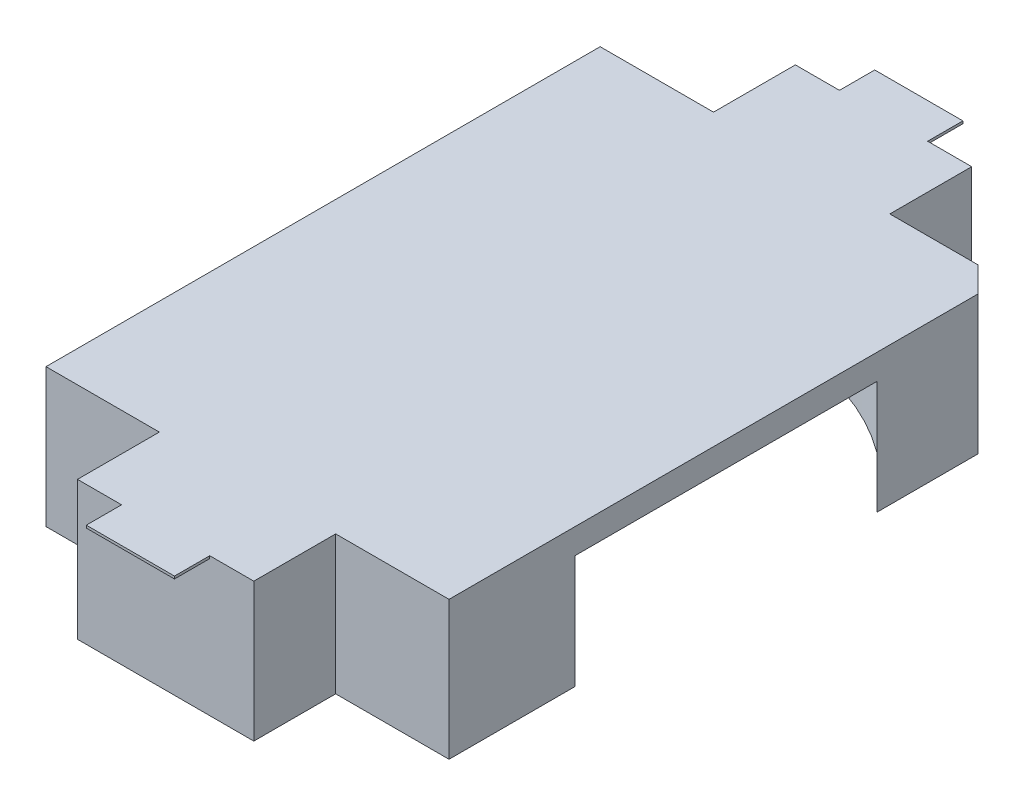
from build123d import *

# Parameters (mm, degrees)
BOSS_EXTRUDE1_DEPTH   = 1
BOSS_EXTRUDE2_DEPTH   = 4.5
SKETCH3_W             = 7
SKETCH3_H             = 3.25
BOSS_EXTRUDE3_DEPTH   = 5.5
SKETCH4_W             = 3.5
SKETCH4_H             = 31.3
BOSS_EXTRUDE4_DEPTH   = 0.1
SKETCH5_W             = 0.994211342
SKETCH5_H             = 2.867053464
BOSS_EXTRUDE6_DEPTH   = 0.1
BOSS_EXTRUDE6_2_DEPTH = 0.1


with BuildPart() as part:
    # Sketch1 → Boss-Extrude1 (new body)
    with BuildSketch(Plane(origin=(0, 0, 0), x_dir=(1, 0, 0), z_dir=(0, 1, 0))):
        Polygon((7, 11), (8, 10), (8, -11), (-8, -11), (-8, 11), align=None)
    extrude(amount=BOSS_EXTRUDE1_DEPTH)

    # Sketch2 → Boss-Extrude2 (add)
    with BuildSketch(Plane.XZ):
        with BuildLine():
            Line((-8, -11), (-8, -6))
            ThreePointArc((-8, -6), (0, -10), (8, -6))
            Line((8, -6), (8, -10))
            Line((8, -10), (7, -11))
            Line((7, -11), (-8, -11))
        make_face()
        with BuildLine():
            Line((-8, 11), (8, 11))
            Line((8, 11), (8, 6))
            ThreePointArc((8, 6), (0, 10), (-8, 6))
            Line((-8, 6), (-8, 11))
        make_face()
    extrude(amount=BOSS_EXTRUDE2_DEPTH)

    # Sketch3 → Boss-Extrude3 (add)
    with BuildSketch(Plane(origin=(0, 1, 0), x_dir=(1, 0, 0), z_dir=(0, 1, 0))):
        with Locations((0, -12.625)):
            Rectangle(SKETCH3_W, SKETCH3_H)
        with Locations((0, 12.625)):
            Rectangle(SKETCH3_W, SKETCH3_H)
    extrude(amount=-BOSS_EXTRUDE3_DEPTH)

    # Sketch4 → Boss-Extrude4 (add)
    with BuildSketch(Plane(origin=(0, 1, 0), x_dir=(1, 0, 0), z_dir=(0, 1, 0))):
        Rectangle(SKETCH4_W, SKETCH4_H)
    extrude(amount=-BOSS_EXTRUDE4_DEPTH)


with BuildPart() as body_2:
    # Sketch5 → Boss-Extrude6 (new body)
    with BuildSketch(Plane.XZ.offset(4.5)):
        with Locations((1.369350497, 9.099983086)):
            Rectangle(SKETCH5_W, SKETCH5_H)
    extrude(amount=-BOSS_EXTRUDE6_DEPTH)


with BuildPart() as body_3:
    # Sketch5 → Boss-Extrude6 2 (new body)
    with BuildSketch(Plane.XZ.offset(4.5)):
        with Locations((-1.369350497, 9.099983086)):
            Rectangle(SKETCH5_W, SKETCH5_H)
    extrude(amount=-BOSS_EXTRUDE6_2_DEPTH)


solid = Compound([part.part, body_2.part, body_3.part])
